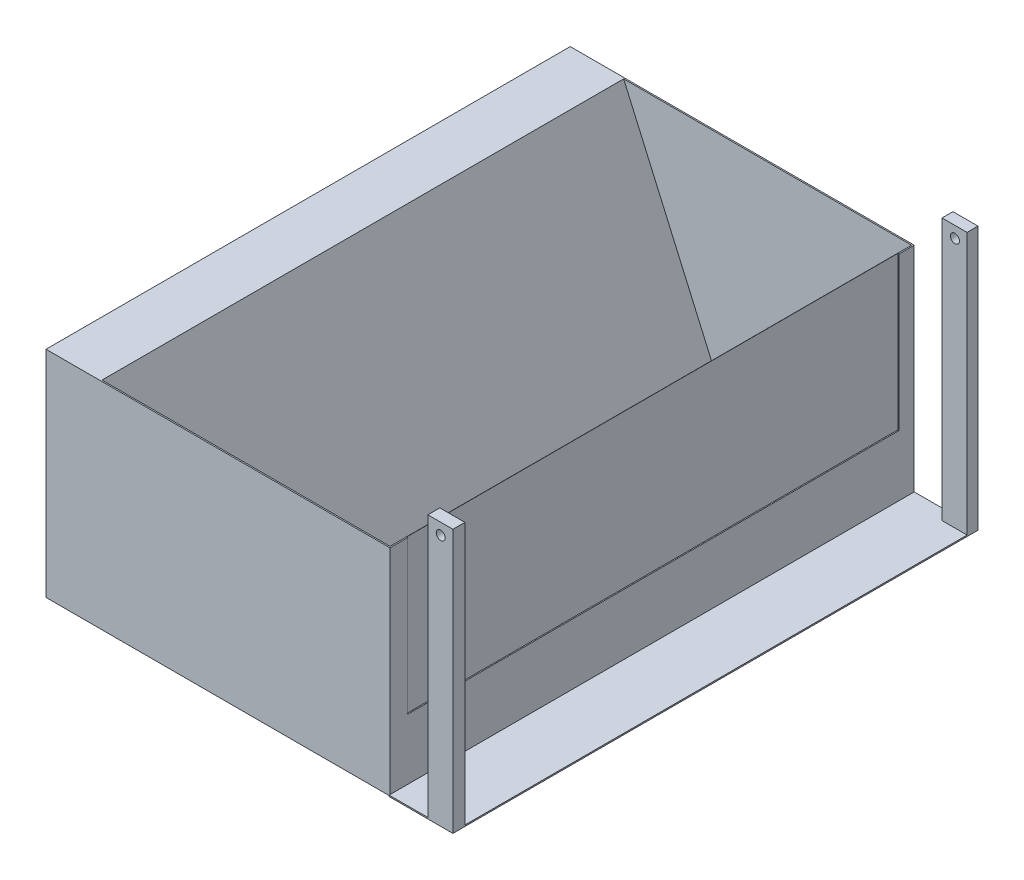
from build123d import *

# Parameters (mm, degrees)
SKETCH1_W                = 800
SKETCH1_H                = 1219.2
BOSS_EXTRUDE1_DEPTH      = 500
SHELL1_T                 = -3
SKETCH5_W                = 1143
SKETCH5_H                = 355.6
CUT_EXTRUDE2_DEPTH       = 2.54
BOSS_EXTRUDE3_DEPTH      = 1219.2
BOSS_EXTRUDE4_DEPTH      = 0.00010033
BOSS_EXTRUDE4_DEPTH_BACK = 3.048
SKETCH7_W                = 148.331634326
SKETCH7_H                = 1221.222643636
SKETCH8_W                = 58.228968179
SKETCH8_H                = 25.4
SKETCH8_H_2              = 27.840540907
BOSS_EXTRUDE5_DEPTH      = 609.6
SKETCH9_R                = 10.450146839
CUT_EXTRUDE3_DEPTH       = 1219.2


with BuildPart() as part:
    # Sketch1 → Boss-Extrude1 (new body)
    with BuildSketch(Plane(origin=(0, 0, 0), x_dir=(1, 0, 0), z_dir=(0, 1, 0))):
        with Locations((-382.91637622, 583.782102729)):
            Rectangle(SKETCH1_W, SKETCH1_H)
    extrude(amount=BOSS_EXTRUDE1_DEPTH)

    # Shell1
    shell1_openings = [part.faces().sort_by_distance(p)[0] for p in [
        (-382.91637622, 500, -583.782102729),
    ]]
    offset(amount=SHELL1_T, openings=shell1_openings, kind=Kind.INTERSECTION)

    # Sketch5 → Cut-Extrude2 (cut)
    with BuildSketch(Plane(origin=(17.08362378, 0, 0), x_dir=(0, 0, -1), z_dir=(1, 0, 0))):
        with Locations((586.856873248, 322.2)):
            Rectangle(SKETCH5_W, SKETCH5_H)
    extrude(amount=-CUT_EXTRUDE2_DEPTH, mode=Mode.SUBTRACT)

    # Sketch6 → Boss-Extrude3 (add)
    with BuildSketch(Plane.XY.offset(25.817897271)):
        Polygon((-436.298693774, 0), (-782.91637622, 0), (-782.91637622, 500), (-655.734510297, 500), align=None)
    extrude(amount=-BOSS_EXTRUDE3_DEPTH)


with BuildPart() as body_2:
    # Sketch7 → Boss-Extrude4 (new, two sides: drawn at the far end of the back side and taken through both)
    with BuildSketch(Plane(origin=(0, 3, 0), x_dir=(1, 0, 0), z_dir=(0, 1, 0)).offset(-BOSS_EXTRUDE4_DEPTH_BACK)):
        with Locations((91.249440943, 582.770780911)):
            Rectangle(SKETCH7_W, SKETCH7_H)
    extrude(amount=BOSS_EXTRUDE4_DEPTH + BOSS_EXTRUDE4_DEPTH_BACK)

    # Sketch8 → Boss-Extrude5 (add)
    with BuildSketch(Plane(origin=(0, 3.00010033, 0), x_dir=(1, 0, 0), z_dir=(0, 1, 0))):
        with Locations((136.300774017, 1180.682102729)):
            Rectangle(SKETCH8_W, SKETCH8_H)
        with Locations((136.300774017, -13.920270454)):
            Rectangle(SKETCH8_W, SKETCH8_H_2)
    extrude(amount=BOSS_EXTRUDE5_DEPTH)

    # Sketch9 → Cut-Extrude3 (cut)
    with BuildSketch(Plane.XY.offset(27.840540907)):
        with Locations((137.096355472, 586.215569874)):
            Circle(SKETCH9_R)
    extrude(amount=-CUT_EXTRUDE3_DEPTH, mode=Mode.SUBTRACT)


solid = Compound([part.part, body_2.part])
